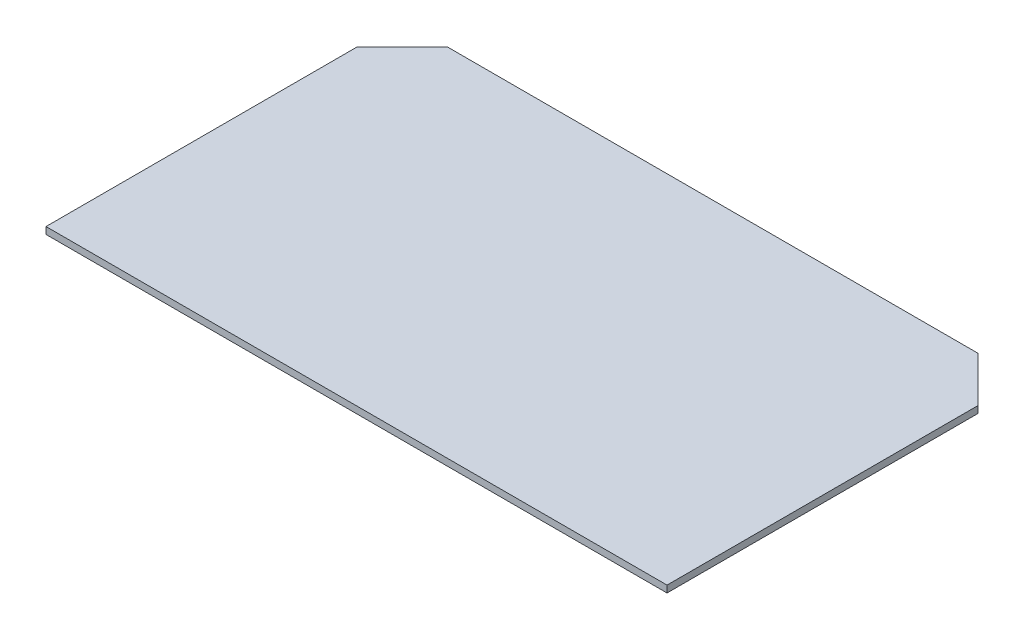
from build123d import *

# Parameters (mm, degrees)
BOSS_EXTRUDE1_DEPTH = 0.762


with BuildPart() as part:
    # Sketch1 → Boss-Extrude1 (new body)
    with BuildSketch(Plane(origin=(0, 0, 0), x_dir=(1, 0, 0), z_dir=(0, 1, 0))):
        Polygon((-46.27124065, 22.863246023), (-46.27124065, -11.680753977), (22.714646205, -11.680753977), (22.714646205, 22.863246023), (17.685702777, 27.892189451), (-41.242297223, 27.892189451), align=None)
    extrude(amount=BOSS_EXTRUDE1_DEPTH)


solid = part.part
